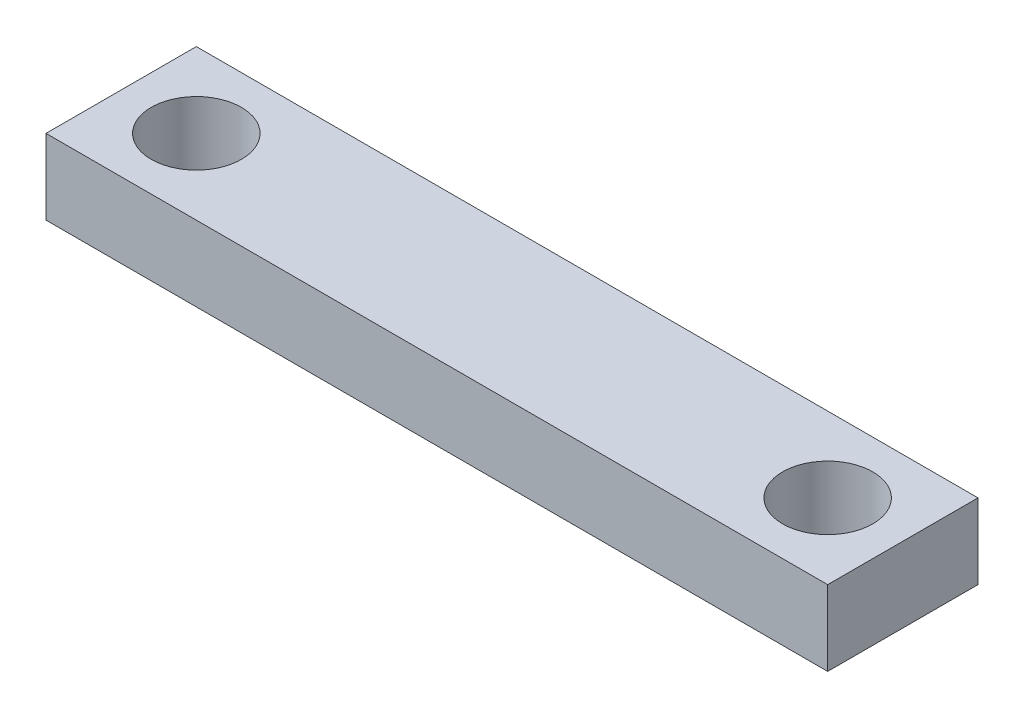
from build123d import *

# Parameters (mm, degrees)
SKETCH1_W           = 52
SKETCH1_H           = 10
SKETCH1_R           = 3
BOSS_EXTRUDE1_DEPTH = 2.5


with BuildPart() as part:
    # Sketch1 → Boss-Extrude1 (new, symmetric)
    with BuildSketch(Plane(origin=(0, 0, 0), x_dir=(1, 0, 0), z_dir=(0, 1, 0))):
        Rectangle(SKETCH1_W, SKETCH1_H)
        with Locations(Location((-21, 0, 0), (0, 0, 270))):
            Circle(SKETCH1_R, mode=Mode.SUBTRACT)
        with Locations(Location((21, 0, 0), (0, 0, 270))):
            Circle(SKETCH1_R, mode=Mode.SUBTRACT)
    extrude(amount=BOSS_EXTRUDE1_DEPTH, both=True)


solid = part.part
